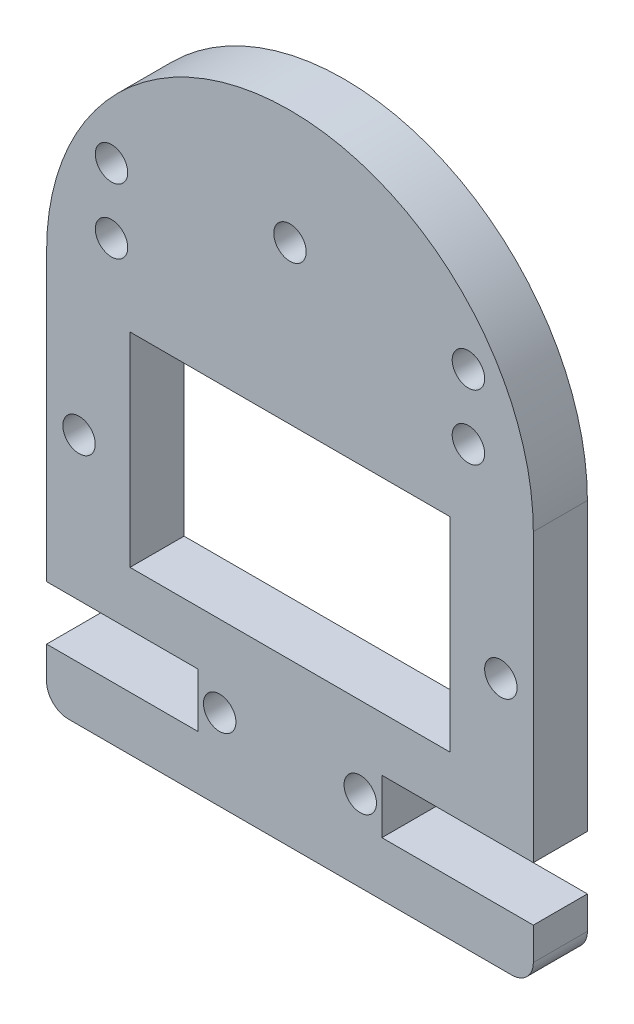
from build123d import *

# Parameters (mm, degrees)
RESSALTO_EXTRUS_O2_DEPTH = 5
ESBO_O9_W                = 29.58
ESBO_O9_H                = 18.85
CORTE_EXTRUS_O1_DEPTH    = 5
ESBO_O10_R               = 1.5
CORTE_EXTRUS_O2_DEPTH    = 5
ESBO_O12_R               = 1.5
CORTE_EXTRUS_O3_DEPTH    = 10
ESBO_O13_R               = 1.5
CORTE_EXTRUS_O4_DEPTH    = 10
ESBO_O14_R               = 1.5
CORTE_EXTRUS_O5_DEPTH    = 76


with BuildPart() as part:
    # Esboço8 → Ressalto-extrusão2 (new body)
    with BuildSketch(Plane.XY):
        with BuildLine():
            Line((-24.266341706, -3.25), (-24.266341706, 13.25))
            ThreePointArc((-24.266341706, 13.25), (-1.766341706, 35.75), (20.733658294, 13.25))
            Line((20.733658294, 13.25), (20.733658294, -3.222268622))
            Line((20.733658294, -3.222268622), (20.733658294, -3.25))
            Line((20.733658294, -3.25), (20.733658294, -13.25))
            Line((20.733658294, -13.25), (6.733658294, -13.25))
            Line((6.733658294, -13.25), (6.733658294, -18.25))
            Line((6.733658294, -18.25), (20.733658294, -18.25))
            Line((20.733658294, -18.25), (20.733658294, -21.25))
            ThreePointArc((20.733658294, -21.25), (20.147871857, -22.664213562), (18.733658294, -23.25))
            Line((18.733658294, -23.25), (-22.266341706, -23.25))
            ThreePointArc((-22.266341706, -23.25), (-23.680555268, -22.664213562), (-24.266341706, -21.25))
            Line((-24.266341706, -21.25), (-24.266341706, -18.25))
            Line((-24.266341706, -18.25), (-10.266341706, -18.25))
            Line((-10.266341706, -18.25), (-10.266341706, -13.25))
            Line((-10.266341706, -13.25), (-24.266341706, -13.25))
            Line((-24.266341706, -13.25), (-24.266341706, -3.25))
        make_face()
    extrude(amount=RESSALTO_EXTRUS_O2_DEPTH)

    # Esboço9 → Corte-extrusão1 (cut)
    with BuildSketch(Plane(origin=(0, 0, 0), x_dir=(-1, 0, 0), z_dir=(0, 0, -1))):
        with Locations((1.766341706, 1.175)):
            Rectangle(ESBO_O9_W, ESBO_O9_H)
    extrude(amount=-CORTE_EXTRUS_O1_DEPTH, mode=Mode.SUBTRACT)

    # Esboço10 → Corte-extrusão2 (cut)
    with BuildSketch(Plane(origin=(0, 0, 0), x_dir=(-1, 0, 0), z_dir=(0, 0, -1))):
        with Locations((-17.733658294, 0)):
            Circle(ESBO_O10_R)
        with Locations((21.266341706, 0)):
            Circle(ESBO_O10_R)
    extrude(amount=-CORTE_EXTRUS_O2_DEPTH, mode=Mode.SUBTRACT)

    # Esboço12 → Corte-extrusão3 (cut)
    with BuildSketch(Plane.XY.offset(5)):
        with Locations((4.733658294, -15.75)):
            Circle(ESBO_O12_R)
        with Locations((-8.266341706, -15.75)):
            Circle(ESBO_O12_R)
    extrude(amount=-CORTE_EXTRUS_O3_DEPTH, mode=Mode.SUBTRACT)

    # Esboço13 → Corte-extrusão4 (cut)
    with BuildSketch(Plane.XY.offset(5)):
        with Locations((-1.766341706, 25.15)):
            Circle(ESBO_O13_R)
    extrude(amount=-CORTE_EXTRUS_O4_DEPTH, mode=Mode.SUBTRACT)

    # Esboço14 → Corte-extrusão5 (cut)
    with BuildSketch(Plane.XY.offset(5)):
        with Locations((14.733658294, 17.25)):
            Circle(ESBO_O14_R)
        with Locations((14.733658294, 23.25)):
            Circle(ESBO_O14_R)
        with Locations((-18.266341706, 23.25)):
            Circle(ESBO_O14_R)
        with Locations((-18.266341706, 17.25)):
            Circle(ESBO_O14_R)
    extrude(amount=-CORTE_EXTRUS_O5_DEPTH, mode=Mode.SUBTRACT)


solid = part.part
